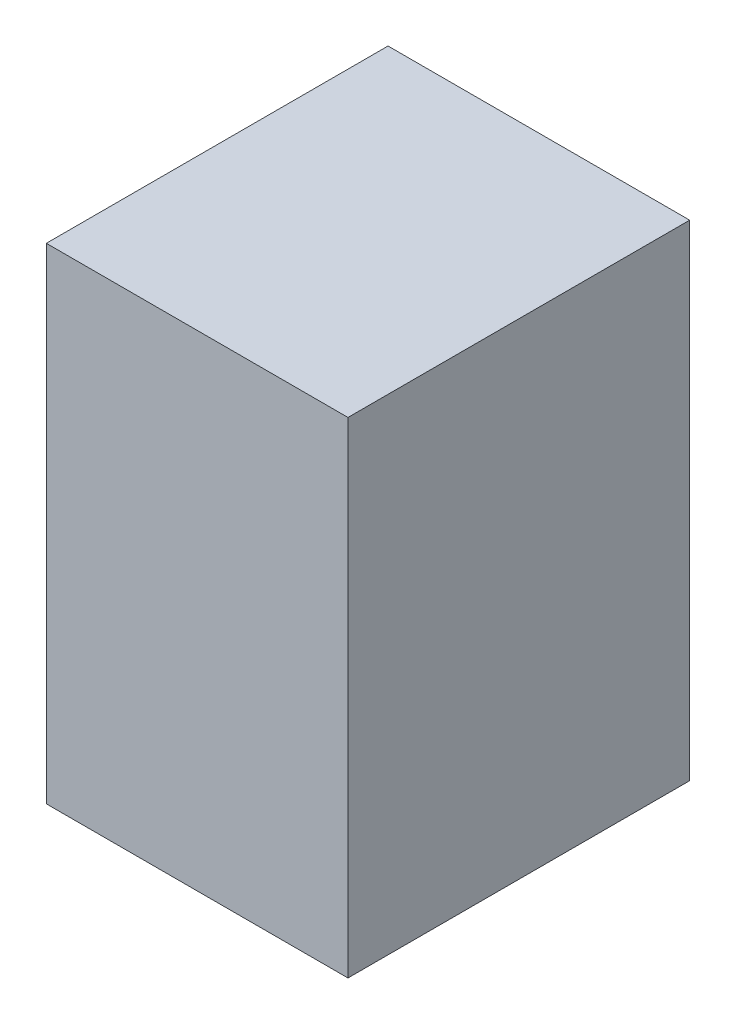
from build123d import *

# Parameters (mm, degrees)
SKETCH1_W           = 64
SKETCH1_H           = 72.5
BOSS_EXTRUDE1_DEPTH = 103


with BuildPart() as part:
    # Sketch1 → Boss-Extrude1 (new body)
    with BuildSketch(Plane(origin=(0, 0, 0), x_dir=(1, 0, 0), z_dir=(0, 1, 0))):
        Rectangle(SKETCH1_W, SKETCH1_H)
    extrude(amount=BOSS_EXTRUDE1_DEPTH)


solid = part.part
